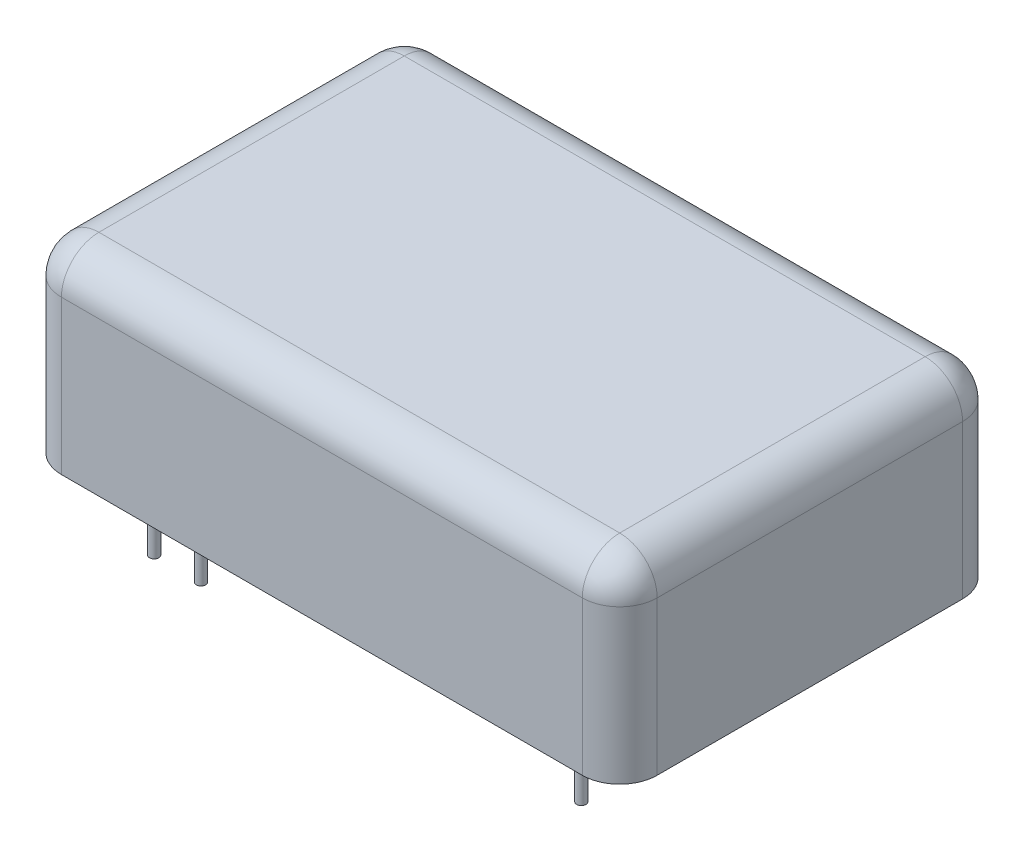
from build123d import *

# Parameters (mm, degrees)
SKETCH_1_W      = 31.8
SKETCH_1_H      = 20.3
EXTRUDE_1_DEPTH = 10.2
SKETCH_2_R      = 0.25
EXTRUDE_2_DEPTH = 3.8
FILLET_1_R      = 2


with BuildPart() as part:
    # Эскиз1 → Бобышка-Вытянуть1 (new body)
    with BuildSketch(Plane(origin=(0, 0, 0), x_dir=(1, 0, 0), z_dir=(0, 1, 0))):
        Rectangle(SKETCH_1_W, SKETCH_1_H)
    extrude(amount=EXTRUDE_1_DEPTH)

    # Эскиз2 → Бобышка-Вытянуть2 (add)
    with BuildSketch(Plane.XZ):
        with Locations(Location((11.3, 7.6, 0), (0, 0, 90))):
            Circle(SKETCH_2_R)
        with Locations(Location((-11.5, 7.6, 0), (0, 0, 90))):
            Circle(SKETCH_2_R)
        with Locations(Location((-9, 7.6, 0), (0, 0, 90))):
            Circle(SKETCH_2_R)
        with Locations(Location((-9, -7.6, 0), (0, 0, 90))):
            Circle(SKETCH_2_R)
        with Locations(Location((-11.5, -7.6, 0), (0, 0, 90))):
            Circle(SKETCH_2_R)
        with Locations(Location((11.3, -7.6, 0), (0, 0, 90))):
            Circle(SKETCH_2_R)
    extrude(amount=EXTRUDE_2_DEPTH)

    # Скругление1
    fillet_1_edges = [part.edges().sort_by_distance(p)[0] for p in [
        (-15.9, 10.2, 0),
        (0, 10.2, 10.15),
        (15.9, 10.2, 0),
        (0, 10.2, -10.15),
        (15.9, 5.1, 10.15),
        (-15.9, 5.1, 10.15),
        (-15.9, 5.1, -10.15),
        (15.9, 5.1, -10.15),
    ]]
    fillet(fillet_1_edges, radius=FILLET_1_R)


solid = part.part
